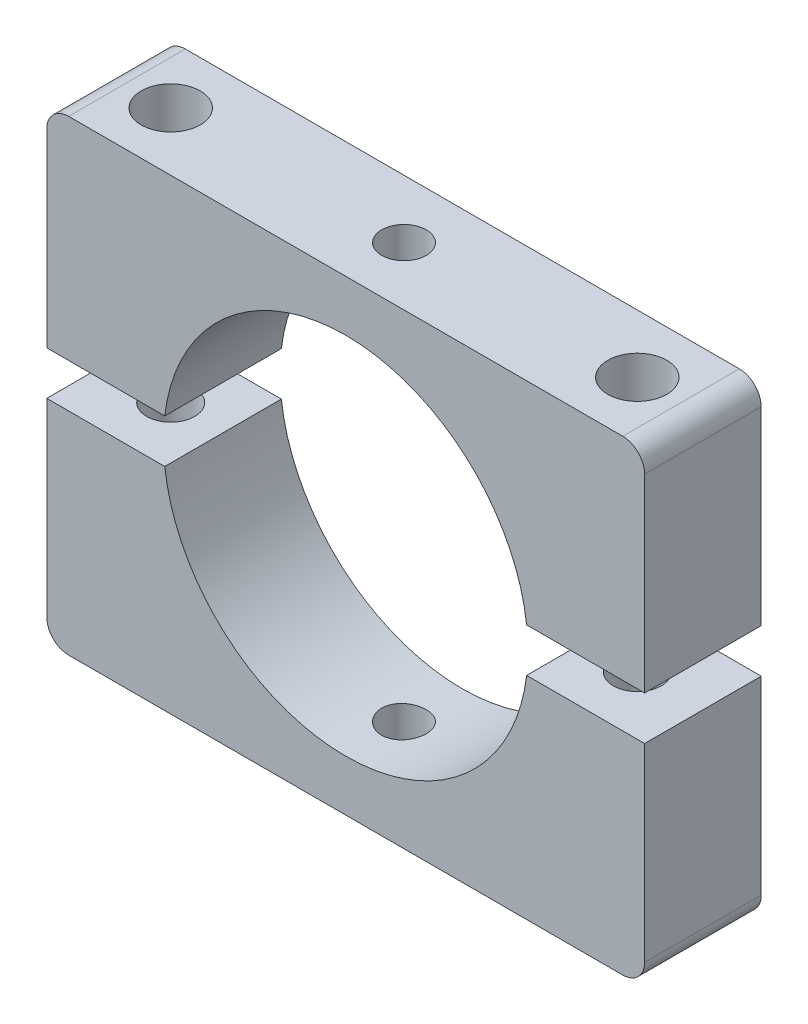
from build123d import *

# Parameters (mm, degrees)
SKETCH_1_W                  = 41
SKETCH_1_H                  = 32
SKETCH_1_R                  = 12.5
EXTRUDE_1_DEPTH             = 4
FILLET_1_R                  = 1.5
SKETCH_2_W                  = 51
SKETCH_2_H                  = 3
CUT_EXTRUDE_2_DEPTH         = 24
SKETCH_3_R                  = 2.025
CUT_EXTRUDE_3_DEPTH         = 14.5
SKETCH_5_W                  = 1.65
SKETCH_5_H                  = 14.5
HOLE_WIZARD_M4_1_AT_2_COUNT = 2
HOLE_WIZARD_M4_1_AT_2_PITCH = 32
CUT_EXTRUDE_START           = -32
SKETCH_6_R                  = 1.525
CUT_EXTRUDE_4_DEPTH         = 32


with BuildPart() as part:
    # 草图1 → 凸台-拉伸1 (new, symmetric)
    with BuildSketch(Plane.XY):
        Rectangle(SKETCH_1_W, SKETCH_1_H)
        Circle(SKETCH_1_R, mode=Mode.SUBTRACT)
    extrude(amount=EXTRUDE_1_DEPTH, both=True)

    # 圆角1
    fillet_1_edges = [part.edges().sort_by_distance(p)[0] for p in [
        (20.5, -16, 0),
        (-20.5, -16, 0),
        (-20.5, 16, 0),
        (20.5, 16, 0),
    ]]
    fillet(fillet_1_edges, radius=FILLET_1_R)

    # 草图2 → 切除-拉伸2 (cut, symmetric)
    with BuildSketch(Plane.XY.offset(4)):
        Rectangle(SKETCH_2_W, SKETCH_2_H)
    extrude(amount=CUT_EXTRUDE_2_DEPTH, both=True, mode=Mode.SUBTRACT)


with BuildPart() as cut_extrude_2_piece_1:
    # of the separate pieces the step leaves, piece 1, a body of its own (cut_extrude_2_pieces)
    add(part.part.solids().sort_by_distance((-19, -16, -4))[0])

    # 草图5 → M4 螺纹孔1 (revolve, cut)
    with BuildSketch(Plane(origin=(-16, -1.5, 0), x_dir=(0, 0, 1), z_dir=(1, 0, 0))):
        with Locations((0.825, 7.25)):
            Rectangle(SKETCH_5_W, SKETCH_5_H)
    hole_wizard_m4_1 = revolve(axis=Axis((-16, 4.85, 0), (0, -1, 0)), mode=Mode.SUBTRACT)

    # M4 螺纹孔1 at 2: M4 螺纹孔1 ×2
    with Locations(*[(i * HOLE_WIZARD_M4_1_AT_2_PITCH, 0, 0) for i in range(1, HOLE_WIZARD_M4_1_AT_2_COUNT)]):
        add(hole_wizard_m4_1, mode=Mode.SUBTRACT)


with BuildPart() as cut_extrude_2_piece_2:
    # of the separate pieces the step leaves, piece 2, a body of its own (cut_extrude_2_pieces)
    add(part.part.solids().sort_by_distance((-20.5, 14.5, -4))[0])

    # 草图3 → 切除-拉伸3 (cut)
    with BuildSketch(Plane(origin=(0, 16, 0), x_dir=(1, 0, 0), z_dir=(0, 1, 0))):
        with Locations(Location((16, 0, 0), (0, 0, 180))):
            Circle(SKETCH_3_R)
        with Locations(Location((-16, 0, 0), (0, 0, 180))):
            Circle(SKETCH_3_R)
    extrude(amount=-CUT_EXTRUDE_3_DEPTH, mode=Mode.SUBTRACT)


with BuildPart() as cut_extrude_4_tool:
    # 草图6 → 切除-拉伸4 (new body)
    with BuildSketch(Plane(origin=(0, 16, 0), x_dir=(1, 0, 0), z_dir=(0, 1, 0)).offset(CUT_EXTRUDE_START)):
        with Locations(Location((0, 0, 0), (0, 0, 270))):
            Circle(SKETCH_6_R)
    extrude(amount=CUT_EXTRUDE_4_DEPTH)


with BuildPart() as cut_extrude_2_piece_1_1:
    add(cut_extrude_2_piece_1.part)

    # 切除-拉伸4: cut by cut_extrude_4_tool
    add(cut_extrude_4_tool.part, mode=Mode.SUBTRACT)


with BuildPart() as cut_extrude_2_piece_2_1:
    add(cut_extrude_2_piece_2.part)

    # 切除-拉伸4: cut by cut_extrude_4_tool
    add(cut_extrude_4_tool.part, mode=Mode.SUBTRACT)


solid = Compound([cut_extrude_2_piece_1_1.part, cut_extrude_2_piece_2_1.part])
